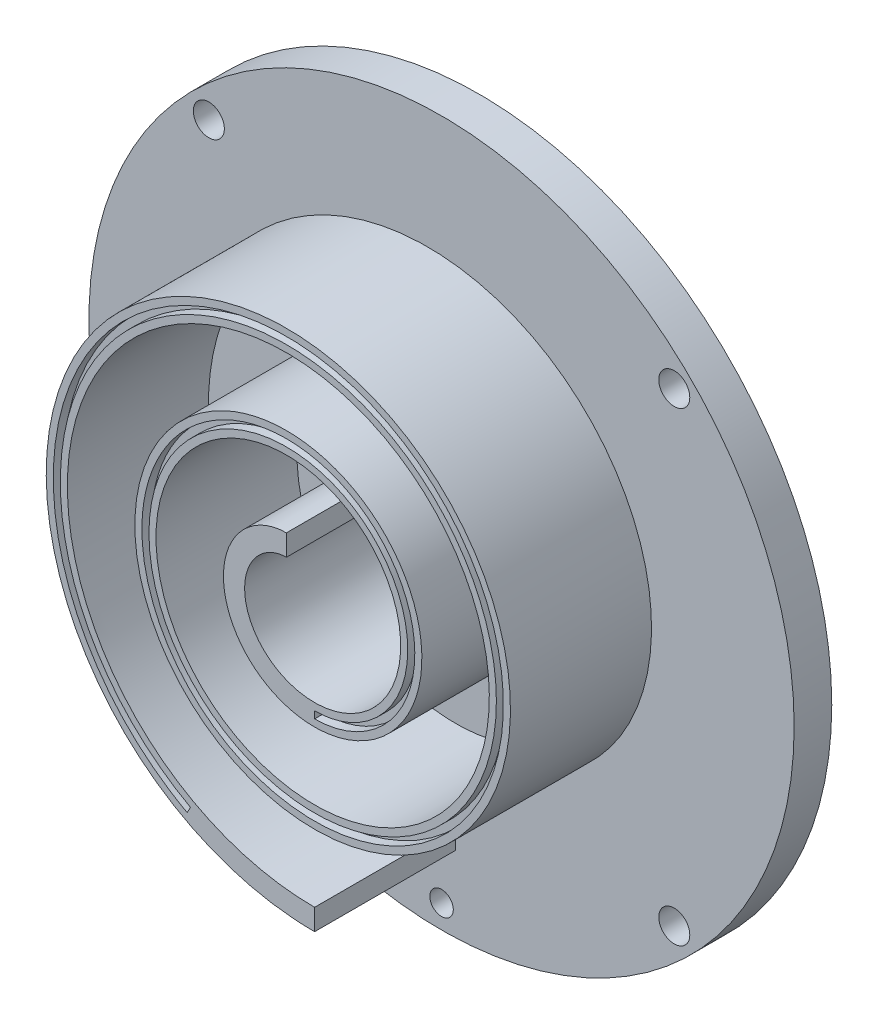
from build123d import *

# Parameters (mm, degrees)
SKETCH_1_R          = 75
EXTRUDE_1_DEPTH     = 8
EXTRUDE_2_DEPTH     = 30
CUT_EXTRUDE_1_DEPTH = 2
SKETCH_4_R          = 5
CUT_EXTRUDE_2_DEPTH = 151
SKETCH_5_R          = 3.3
CUT_EXTRUDE_3_DEPTH = 151
SKETCH_6_R          = 2.5
CUT_EXTRUDE_4_DEPTH = 151


with BuildPart() as part:
    # 草图1 → 凸台-拉伸1 (new body)
    with BuildSketch(Plane.XY):
        Circle(SKETCH_1_R)
    extrude(amount=EXTRUDE_1_DEPTH)

    # 草图2 → 凸台-拉伸2 (add)
    with BuildSketch(Plane.XY.offset(8)):
        with BuildLine():
            Line((3, -54.298668), (3, -58.79729))
            Line((3, -58.79729), (3, -58.798668))
            add(Edge.make_bspline(
                [(3, -58.798668), (2.399163725, -58.793351037), (1.19843255, -58.782725443), (-0.599559513, -58.696823613), (-2.391350558, -58.55998079), (-4.175267711, -58.367486226), (-5.949650082, -58.121031715), (-7.712851259, -57.820661267), (-9.463241735, -57.466927566), (-11.199207925, -57.060305538), (-12.919156155, -56.601354812), (-14.621511503, -56.090671901), (-16.304721417, -55.52890275), (-17.967257478, -54.916743876), (-19.607614199, -54.254929986), (-21.224312926, -53.544247219), (-22.815901623, -52.785521968), (-24.380956219, -51.979624306), (-25.918084432, -51.127468104), (-27.425923557, -50.230007536), (-28.90314069, -49.288231974), (-30.348441839, -48.303179229), (-31.760561458, -47.275915216), (-33.138274841, -46.207550095), (-34.48039039, -45.099224829), (-35.785754466, -43.952114907), (-37.053255735, -42.767433687), (-38.281814759, -41.546417556), (-39.470402531, -40.29034371), (-40.618022868, -39.000510051), (-41.723726567, -37.678246764), (-42.786605483, -36.324909452), (-43.805796004, -34.94187913), (-44.7804781, -33.530560058), (-45.709875216, -32.092378115), (-46.593262314, -30.628782975), (-47.429950938, -29.141239049), (-48.219309597, -27.631233319), (-48.960745024, -26.100266013), (-49.65371852, -24.549854443), (-50.297733421, -22.98152775), (-50.892346787, -21.396828633), (-51.437157395, -19.797307994), (-51.931820016, -18.184528203), (-52.376033478, -16.560057811), (-52.769546713, -14.925471308), (-53.112155687, -13.282347694), (-53.403712626, -11.632269388), (-53.644108011, -9.976818353), (-53.833290995, -8.317578092), (-53.971255602, -6.656129822), (-54.058041109, -4.994051756), (-54.093742061, -3.332917236), (-54.078498598, -1.674293185), (-54.012495364, -0.019738724), (-53.895969357, 1.629195389), (-53.729204079, 3.270969632), (-53.512525665, 4.904055859), (-53.246313981, 6.526940691), (-52.930985802, 8.138123828), (-52.567013431, 9.736123429), (-52.15490373, 11.319472854), (-51.695213297, 12.886725605), (-51.188542341, 14.436455638), (-50.635532525, 15.967258841), (-50.036865078, 17.477752453), (-49.393265664, 18.966579073), (-48.705501955, 20.432407242), (-47.974372287, 21.873928602), (-47.200724243, 23.289866958), (-46.385434055, 24.678970946), (-45.529422517, 26.040022955), (-44.633639962, 27.371833506), (-43.699071968, 28.67324441), (-42.72674119, 29.943133615), (-41.717698476, 31.180410128), (-40.67302916, 32.384019978), (-39.593846308, 33.552943062), (-38.481293754, 34.686197451), (-37.336541566, 35.782837617), (-36.160786422, 36.84195649), (-34.955252323, 37.862686625), (-33.721184007, 38.844197693), (-32.459853105, 39.785704312), (-31.172548609, 40.686456926), (-29.860582238, 41.54575156), (-28.52528296, 42.362922193), (-27.167998815, 43.137349812), (-25.790092445, 43.868454168), (-24.392941786, 44.555700731), (-22.977938708, 45.19859872), (-21.546486565, 45.796701082), (-20.099999393, 46.349603852), (-18.639900434, 46.856949863), (-17.167620331, 47.318422073), (-15.684597187, 47.733756025), (-14.192272979, 48.102723093), (-12.692094221, 48.425148445), (-11.185508795, 48.700894744), (-9.673965969, 48.92987347), (-8.158914732, 49.112043059), (-6.641801284, 49.247400277), (-5.124068626, 49.335992555), (-3.607155686, 49.377909769), (-2.092494786, 49.373284318), (-0.581511283, 49.322294808), (0.924378846, 49.225162034), (2.423769591, 49.082149981), (3.91526624, 48.89356556), (5.397486593, 48.659759233), (6.869063127, 48.381121974), (8.328641844, 48.058083759), (9.774888496, 47.691122966), (11.206482173, 47.280746971), (12.622125056, 46.827512534), (14.02053736, 46.332011045), (15.400459729, 45.7948685), (16.760657693, 45.216756546), (18.099917753, 44.598376682), (19.417052507, 43.940468062), (20.710899768, 43.243804774), (21.980323926, 42.509195083), (23.224216841, 41.73748088), (24.441500194, 40.92953689), (25.631121523, 40.086263613), (26.79206469, 39.208601044), (27.923339287, 38.297509994), (29.023989816, 37.353984298), (30.093093717, 36.379043614), (31.129761433, 35.373733577), (32.13313704, 34.339123477), (33.10240023, 33.276308112), (34.036769752, 32.186406964), (34.935493253, 31.070554345), (35.797864245, 29.929912795), (36.623206625, 28.765658252), (37.410884801, 27.578987356), (38.160303111, 26.371112947), (38.870902832, 25.143262759), (39.542165748, 23.896679448), (40.173611952, 22.632618381), (40.764801647, 21.352346257), (41.315337225, 20.057141391), (41.824858984, 18.748289939), (42.293047507, 17.427086468), (42.719628492, 16.094832909), (43.104363526, 14.752835841), (43.447057526, 13.40240578), (43.747555504, 12.044856623), (44.005744516, 10.681503127), (44.221550156, 9.313660978), (44.394943144, 7.942644529), (44.52592955, 6.569765701), (44.614561549, 5.196333071), (44.660924525, 3.823650673), (44.665152296, 2.453015949), (44.627410118, 1.085719487), (44.54791087, -0.276956926), (44.426897602, -1.633740068), (44.264660731, -2.983368981), (44.061523172, -4.324593905), (43.817847784, -5.656178545), (43.534036274, -6.976901287), (43.210519314, -8.285554405), (42.847777467, -9.580949415), (42.446312633, -10.861912382), (42.006670405, -12.127289726), (41.529429006, -13.375948694), (41.015197971, -14.606774447), (40.46462131, -15.818675866), (39.878376449, -17.010584489), (39.257169088, -18.181454588), (38.601736276, -19.330264885), (37.912848145, -20.456021221), (37.191297492, -21.557752702), (36.437911501, -22.634519062), (35.653538394, -23.68540606), (34.839058849, -24.70952543), (33.995364601, -25.706033368), (32.834104822, -26.995260991), (31.314179994, -28.53417107), (29.386951067, -30.259713946), (27.366369456, -31.856860964), (25.260939157, -33.320637483), (23.079366189, -34.64668758), (20.830583633, -35.831201319), (18.523698816, -36.870943919), (16.167966253, -37.76327032), (13.772741499, -38.506114199), (11.34745112, -39.098006303), (8.901550865, -39.538060906), (6.444493231, -39.825992572), (3.98568607, -39.962085986), (1.534460534, -39.94722032), (-0.899966031, -39.782830279), (-3.308524808, -39.470924245), (-5.682327373, -39.014044123), (-8.012702526, -38.415276178), (-10.291223256, -37.678210823), (-12.50974169, -36.806945801), (-14.66041309, -35.806045766), (-16.735728506, -34.680537627), (-18.728537915, -33.435874943), (-20.632074426, -32.077916772), (-22.439978298, -30.612902977), (-24.146319011, -29.047424734), (-25.745608211, -27.388393127), (-27.232828579, -25.643017361), (-28.603435001, -23.818763318), (-29.853375738, -21.923328855), (-30.979106595, -19.964612965), (-31.977589056, -17.95067636), (-32.84630975, -15.889716119), (-33.583272919, -13.790025888), (-34.18701355, -11.65996817), (-34.656593931, -9.507937937), (-34.9916007, -7.342330068), (-35.192139705, -5.171506949), (-35.258840866, -3.00376665), (-35.192833031, -0.847310827), (-34.995755121, 1.289787194), (-34.669724187, 3.399610566), (-34.217340793, 5.474430887), (-33.641658384, 7.506733276), (-32.946179176, 9.489247274), (-32.13482769, 11.414969863), (-31.211935122, 13.277191246), (-30.182217345, 15.069518493), (-29.050750458, 16.785895463), (-27.822948958, 18.420624106), (-26.50454521, 19.968386091), (-25.101554324, 21.424253354), (-23.620254973, 22.783708332), (-22.067159868, 24.042655656), (-20.448986113, 25.197433113), (-18.77263055, 26.244824331), (-17.04513463, 27.182059333), (-15.273662923, 28.006831477), (-13.465467655, 28.717293091), (-11.627859738, 29.312056129), (-9.768184142, 29.790207036), (-7.893783424, 30.151281828), (-6.011975311, 30.395288577), (-4.130020347, 30.522676756), (-2.255095363, 30.534355047), (-0.394265823, 30.431662495), (1.445541614, 30.216372013), (3.257562572, 29.890665363), (5.0352234, 29.457138411), (6.772160724, 28.918764204), (8.462249293, 28.278897798), (10.099616357, 27.541237515), (11.678670993, 26.709828568), (13.1941142, 25.789023863), (14.640962337, 24.78347337), (16.014560826, 23.698100366), (17.310600487, 22.538078308), (18.525124093, 21.308802269), (19.654551091, 20.015877143), (20.695669773, 18.665076687), (21.645664146, 17.262335169), (22.502100966, 15.813705775), (23.262954888, 14.325348693), (23.926592515, 12.803494273), (24.491788992, 11.254425227), (24.957716374, 9.684446165), (25.323953104, 8.099861382), (25.590468117, 6.506946135), (25.757625769, 4.911924322), (25.826175779, 3.320943723), (25.797246812, 1.740051611), (25.672329098, 0.175173238), (25.45327733, -1.367912474), (25.142285914, -2.88359209), (24.74188588, -4.366440801), (24.254918029, -5.811237353), (23.684533868, -7.212988841), (23.034159049, -8.566939723), (22.307491468, -9.868594479), (21.508478982, -11.113731206), (20.641291878, -12.298410489), (19.710313856, -13.418992936), (18.7201148, -14.472147283), (17.675429934, -15.454857106), (16.581141718, -16.364434898), (15.442255081, -17.198523185), (14.263873893, -17.955100037), (13.051182905, -18.632484569), (11.809421796, -19.229337331), (10.543864031, -19.744660202), (9.259796401, -20.177799897), (7.96249331, -20.528434592), (6.657200489, -20.796587306), (5.349108192, -20.982604585), (4.043334928, -21.087156765), (2.744906157, -21.11123461), (1.458734255, -21.056131551), (0.189600415, -20.923438745), (-1.057862934, -20.715036668), (-2.279188438, -20.433072508), (-3.470092151, -20.079961959), (-4.626486414, -19.658361336), (-5.744491917, -19.171157298), (-6.820456374, -18.621457434), (-7.850959133, -18.012561923), (-8.832827542, -17.347956481), (-9.763144237, -16.631291327), (-10.63925231, -15.866360066), (-11.458765357, -15.05708494), (-12.219575001, -14.207500612), (-12.919847667, -13.321726192), (-13.558036793, -12.403956519), (-14.132878167, -11.458436594), (-14.643391519, -10.489444361), (-15.088882335, -9.50127333), (-15.468936208, -8.498211471), (-15.783422718, -7.484525975), (-16.032476379, -6.464441064), (-16.216509686, -5.44212543), (-16.336193495, -4.421672648), (-16.392453095, -3.407083677), (-16.386460736, -2.402254334), (-16.319625286, -1.410957617), (-16.193579527, -0.436831771), (-16.010173617, 0.516635118), (-15.771460163, 1.446117229), (-15.479676845, 2.348460582), (-15.137241754, 3.220695732), (-14.746733125, 4.060045726), (-14.310879344, 4.863937858), (-13.832536613, 5.630005617), (-13.314681323, 6.356101036), (-12.7603904, 7.040295157), (-12.17282846, 7.680887402), (-11.555225656, 8.276400839), (-10.910870697, 8.825594305), (-10.243086097, 9.327454779), (-9.555216939, 9.781200262), (-8.850617017, 10.186282877), (-8.132626479, 10.542376743), (-7.404566095, 10.849383043), (-6.66971111, 11.107439414), (-5.931288534, 11.316801959), (-5.192454744, 11.478329239), (-4.456285569, 11.591617545), (-3.725764481, 11.661801679), (-3.240666522, 11.670474998), (-3, 11.674778)],
                knots=[0, 0, 0, 0, 0.003256773, 0.006508444, 0.009755014, 0.012996483, 0.016232849, 0.019464112, 0.022690274, 0.025911335, 0.029127293, 0.032338151, 0.035543905, 0.038744557, 0.041940107, 0.045130558, 0.048315904, 0.051496149, 0.054671292, 0.057841334, 0.061006274, 0.064166112, 0.067320847, 0.07047048, 0.073615013, 0.076754442, 0.079888771, 0.083017997, 0.08614212, 0.089261143, 0.092375063, 0.095483883, 0.0985876, 0.101686215, 0.104779728, 0.107868138, 0.110951449, 0.114029655, 0.117102761, 0.120170764, 0.123233665, 0.126291465, 0.129344162, 0.132391758, 0.135434254, 0.138471646, 0.141503936, 0.144531124, 0.14755321, 0.150570195, 0.153582078, 0.156588859, 0.159590537, 0.162587114, 0.165578589, 0.168564963, 0.171546234, 0.174522403, 0.177493471, 0.180459437, 0.1834203, 0.186376063, 0.189326724, 0.19227228, 0.195212736, 0.198148092, 0.201078343, 0.204003494, 0.206923543, 0.20983849, 0.212748334, 0.215653078, 0.218552719, 0.221447259, 0.224336696, 0.22722103, 0.230100265, 0.232974396, 0.235843424, 0.238707353, 0.241566179, 0.244419904, 0.247268525, 0.250112045, 0.252950464, 0.25578378, 0.258611996, 0.261435108, 0.264253118, 0.267066027, 0.269873834, 0.272676539, 0.275474144, 0.278266644, 0.281054044, 0.283836341, 0.286613537, 0.28938563, 0.292152622, 0.294914513, 0.2976713, 0.300422987, 0.30316957, 0.305911054, 0.308647435, 0.311378713, 0.314104889, 0.316825964, 0.319541937, 0.322252809, 0.324958576, 0.327659245, 0.330354809, 0.333045274, 0.335730634, 0.338410894, 0.341086053, 0.343756109, 0.346421063, 0.349080914, 0.351735665, 0.354385314, 0.35702986, 0.359669304, 0.362303647, 0.364932888, 0.367557026, 0.370176064, 0.372789998, 0.375398832, 0.378002564, 0.380601193, 0.38319472, 0.385783145, 0.38836647, 0.390944692, 0.393517812, 0.396085829, 0.398648745, 0.40120656, 0.403759272, 0.406306882, 0.408849392, 0.411386798, 0.413919103, 0.416446306, 0.418968408, 0.421485406, 0.423997304, 0.426504099, 0.429005793, 0.431502384, 0.433993874, 0.436480262, 0.438961548, 0.441437731, 0.443908814, 0.446374795, 0.448835673, 0.451291448, 0.453742124, 0.456187696, 0.458628166, 0.461063535, 0.463493803, 0.465918967, 0.468339031, 0.470753991, 0.473163852, 0.475568609, 0.477968264, 0.480362819, 0.482752271, 0.485136621, 0.487515869, 0.489890014, 0.492259058, 0.494623001, 0.496981842, 0.49933558, 0.504027199, 0.508698415, 0.513349224, 0.517979628, 0.522589626, 0.527179219, 0.531748408, 0.536297191, 0.540825569, 0.545333543, 0.549821111, 0.554288273, 0.55873503, 0.563161382, 0.56756733, 0.571952872, 0.576318009, 0.58066274, 0.584987066, 0.589290989, 0.593574504, 0.597837615, 0.602080321, 0.606302621, 0.610504518, 0.614686006, 0.618847092, 0.622987772, 0.627108046, 0.631207916, 0.635287381, 0.639346439, 0.643385095, 0.647403343, 0.651401187, 0.655378625, 0.659335659, 0.663272287, 0.66718851, 0.671084329, 0.674959741, 0.678814749, 0.682649352, 0.686463548, 0.69025734, 0.694030727, 0.697783709, 0.701516285, 0.705228457, 0.708920224, 0.712591585, 0.716242541, 0.719873091, 0.723483237, 0.727072976, 0.730642313, 0.734191243, 0.737719767, 0.741227888, 0.744715602, 0.748182911, 0.751629815, 0.755056314, 0.758462409, 0.761848097, 0.76521338, 0.768558259, 0.771882732, 0.7751868, 0.778470463, 0.781733721, 0.784976573, 0.788199021, 0.791401064, 0.794582699, 0.797743932, 0.800884759, 0.804005179, 0.807105196, 0.810184808, 0.813244014, 0.816282815, 0.819301209, 0.8222992, 0.825276786, 0.828233966, 0.831170742, 0.834087111, 0.836983075, 0.839858636, 0.84271379, 0.84554854, 0.848362883, 0.851156822, 0.853930355, 0.856683484, 0.859416207, 0.862128526, 0.864820439, 0.867491946, 0.870143049, 0.872773747, 0.875384039, 0.877973927, 0.880543408, 0.883092486, 0.885621157, 0.888129424, 0.890617285, 0.89308474, 0.895531793, 0.897958438, 0.900364678, 0.902750513, 0.905115945, 0.907460969, 0.909785589, 0.912089804, 0.914373614, 0.916637018, 0.918880017, 0.921102611, 0.923304802, 0.925486584, 0.927647963, 0.929788936, 0.931909504, 0.934009669, 0.936089426, 0.938148779, 0.940187727, 0.942206269, 0.944204407, 0.946182139, 0.948139466, 0.950076387, 0.951992903, 0.953889016, 0.955764722, 0.957620024, 0.959454918, 0.96126941, 0.963063496, 0.964837176, 0.966590451, 0.96832332, 0.970035786, 0.971727847, 0.973399501, 0.975050749, 0.976681595, 0.978292033, 0.979882068, 0.981451697, 0.983000921, 0.984529739, 0.986038151, 0.987526159, 0.988993763, 0.990440961, 0.991867753, 0.993274141, 0.994660123, 0.9960257, 0.997370872, 0.998695639, 1, 1, 1, 1], degree=3))
            Line((-3, 11.674778), (-3, 7.17467))
            add(Edge.make_bspline(
                [(-3, 7.17467), (-3.301005833, 7.163730291), (-3.918079079, 7.141303476), (-4.851790294, 6.959113795), (-5.800196038, 6.659196787), (-6.745661661, 6.224043616), (-7.669354317, 5.653415964), (-8.551579667, 4.945499295), (-9.372088364, 4.102648212), (-9.982059301, 3.299010945), (-10.420550009, 2.596605844), (-10.724703638, 2.035521357), (-10.998632776, 1.446619949), (-11.240068093, 0.831504433), (-11.44680876, 0.191992274), (-11.616758854, -0.469938904), (-11.747934724, -1.152142345), (-11.838481464, -1.852312321), (-11.886687086, -2.567991075), (-11.890983973, -3.296579139), (-11.849972076, -4.035342542), (-11.762421449, -4.781424236), (-11.627285208, -5.531854905), (-11.443706443, -6.283564764), (-11.211032545, -7.033396504), (-10.928814418, -7.778117065), (-10.596818196, -8.514432691), (-10.215027793, -9.239001944), (-9.783658558, -9.948454271), (-9.303144483, -10.639396486), (-8.774160424, -11.308439813), (-8.197607822, -11.952205372), (-7.574624745, -12.567345872), (-6.906582995, -13.150561314), (-6.195082957, -13.698609963), (-5.441958956, -14.208334594), (-4.649267055, -14.676666449), (-3.819286562, -15.10065191), (-2.95451031, -15.477460279), (-2.057638908, -15.804402963), (-1.1315734, -16.078947307), (-0.179405327, -16.298731827), (0.795593681, -16.461577763), (1.78998237, -16.565507549), (2.800162761, -16.608748939), (3.822391984, -16.589756649), (4.852796911, -16.507216035), (5.887388915, -16.360054746), (6.922079524, -16.147458162), (7.952695067, -15.868863875), (8.974996248, -15.523988191), (9.984690869, -15.112810397), (10.977458287, -14.635599573), (11.94895942, -14.092898112), (12.894864117, -13.485541947), (13.810861877, -12.814649062), (14.69268787, -12.081627149), (15.536136195, -11.288168675), (16.337083884, -10.436250867), (17.091506136, -9.528130707), (17.795497522, -8.566339894), (18.445290926, -7.553680634), (19.037273777, -6.493214762), (19.568007081, -5.388257985), (20.034245916, -4.242369538), (20.432950226, -3.059339656), (20.761308049, -1.843178439), (21.016744092, -0.598101303), (21.196939637, 0.671484529), (21.299845327, 1.960994899), (21.323690548, 3.265687108), (21.267001636, 4.580675874), (21.128607196, 5.900952868), (20.907648523, 7.221404156), (20.603591346, 8.536831196), (20.216229519, 9.841971023), (19.745692941, 11.131517965), (19.192449195, 12.400142536), (18.557311555, 13.642517132), (17.841436553, 14.853334638), (17.046323828, 16.027332195), (16.173820378, 17.159314988), (15.226110449, 18.244175188), (14.20571995, 19.276920125), (13.115500084, 20.252686194), (11.958632628, 21.166770695), (10.738610938, 22.014644858), (9.459236886, 22.791980051), (8.12460437, 23.494663936), (6.739093184, 24.118830258), (5.307345837, 24.660860059), (3.834263005, 25.117424145), (2.324976688, 25.485474282), (0.784839878, 25.762282124), (-0.780595761, 25.945442886), (-2.36560024, 26.032886867), (-3.964283666, 26.022904804), (-5.570620873, 25.914144345), (-7.178472767, 25.705638045), (-8.781609287, 25.39679005), (-10.373735042, 24.987407232), (-11.948511601, 24.477683816), (-13.499586276, 23.86822366), (-15.020613755, 23.16002732), (-16.505285083, 22.354505629), (-17.947351004, 21.453471468), (-19.340650399, 20.459142162), (-20.679131983, 19.374129041), (-21.95688853, 18.201442907), (-23.16817219, 16.944473907), (-24.307427185, 15.606992451), (-25.369308462, 14.193131925), (-26.348713877, 12.707383476), (-27.240797966, 11.154574699), (-28.041003537, 9.539860959), (-28.74507585, 7.868703095), (-29.349088781, 6.146853688), (-29.849459644, 4.380333335), (-30.242972224, 2.575413816), (-30.526793603, 0.738592998), (-30.698483087, -1.123427528), (-30.756015729, -3.003766979), (-30.697789924, -4.895390601), (-30.522638774, -6.791136097), (-30.229843248, -8.683741271), (-29.819133589, -10.565870776), (-29.290703255, -12.430145866), (-28.645206123, -14.269171491), (-27.883764939, -16.075566954), (-27.007970669, -17.841996707), (-26.01987308, -19.561193711), (-24.921994535, -21.226000098), (-23.717306006, -22.829384483), (-22.409235722, -24.364481066), (-21.001652762, -25.82461414), (-19.498856017, -27.20332483), (-17.905564619, -28.494403223), (-16.226902532, -29.691913167), (-14.468383604, -30.79022021), (-12.635891754, -31.784013964), (-10.735664229, -32.668337037), (-8.774267417, -33.438604168), (-6.758576554, -34.0906243), (-4.695752936, -34.620630143), (-2.593213948, -35.025277509), (-0.45861227, -35.301688921), (1.700196679, -35.447446289), (3.87518086, -35.460617293), (6.058162794, -35.33977116), (8.240849409, -35.083973092), (10.414864801, -34.692814867), (12.571780743, -34.166399853), (14.70315084, -33.505366043), (16.800543203, -32.710877893), (18.855571379, -31.784627534), (20.859932367, -30.728838736), (22.805436263, -29.54625956), (24.684041302, -28.240156286), (26.487884915, -26.814306106), (28.209319854, -25.272989587), (29.840940968, -23.620973859), (31.375622653, -21.863504428), (32.806545293, -20.006284226), (34.127222375, -18.055455658), (35.331539091, -16.017586107), (36.41376769, -13.899639521), (37.368601652, -11.708956971), (38.191177901, -9.453230468), (38.87709439, -7.140473606), (39.422447135, -4.778998559), (39.823826121, -2.377379994), (40.078358865, 0.055570125), (40.183709482, 2.510839817), (40.138091475, 4.979247168), (39.940296526, 7.451476554), (39.589685854, 9.918112123), (39.086203787, 12.369674984), (38.430393872, 14.79666044), (37.623380812, 17.189571216), (36.666891884, 19.538958227), (35.563243292, 21.835457772), (34.315340086, 24.069821918), (32.92665999, 26.232979043), (31.401305324, 28.315991692), (30.021469267, 29.976204711), (28.854538112, 31.255757518), (27.947279505, 32.191254668), (27.009734166, 33.100439371), (26.04265161, 33.982342384), (25.046827897, 34.836001912), (24.023088326, 35.660485368), (22.972286427, 36.454880345), (21.89530756, 37.218302636), (20.793063612, 37.94988975), (19.666498233, 38.64881137), (18.516579812, 39.314261523), (17.34430286, 39.945462288), (16.150689817, 40.541670298), (14.936786193, 41.102168297), (13.703660309, 41.626268698), (12.452407252, 42.113323004), (11.18414051, 42.562708643), (9.899996556, 42.973840543), (8.601130696, 43.346166188), (7.288717707, 43.679168099), (5.963950119, 43.972366277), (4.628037612, 44.225314725), (3.282204702, 44.437604682), (1.927691793, 44.60886611), (0.565751434, 44.738766404), (-0.802350879, 44.827009275), (-2.175338744, 44.873342066), (-3.551925689, 44.877542296), (-4.930816396, 44.839438718), (-6.310708499, 44.758889069), (-7.690293499, 44.635799608), (-9.068257711, 44.470112271), (-10.443283157, 44.261811249), (-11.814049999, 44.010921774), (-13.179236458, 43.717508688), (-14.537521779, 43.381679167), (-15.887585272, 43.003579155), (-17.228111238, 42.583402637), (-18.55778416, 42.121373358), (-19.875297337, 41.617768775), (-21.179348043, 41.072896752), (-22.468641569, 40.487110071), (-23.741895494, 39.860807002), (-24.997831328, 39.194414871), (-26.23518816, 38.488412957), (-27.452715201, 37.743313627), (-28.64917543, 36.959669425), (-29.823349611, 36.138075103), (-30.97403128, 35.279159937), (-32.10003409, 34.383593336), (-33.200192334, 33.452085183), (-34.27335608, 32.485376187), (-35.318400653, 31.484249649), (-36.334223851, 30.449524078), (-37.319743073, 29.382048876), (-38.273905538, 28.282713183), (-39.195683004, 27.152438149), (-40.084072254, 25.992176985), (-40.93809911, 24.802916508), (-41.756819395, 23.585674703), (-42.539321406, 22.341502933), (-43.284717282, 21.071476361), (-43.992161311, 19.776706044), (-44.660830818, 18.45832406), (-45.289945734, 17.117495213), (-45.87875411, 15.755406704), (-46.426546809, 14.373273317), (-46.932641498, 12.972329951), (-47.396404451, 11.553837704), (-47.817229762, 10.119076751), (-48.194559563, 8.669349796), (-48.527867651, 7.205976755), (-48.816672447, 5.730296622), (-49.060533927, 4.243665292), (-49.259048621, 2.747453568), (-49.411858827, 1.243047016), (-49.518650824, -0.268155917), (-49.579147361, -1.784745507), (-49.593121553, -3.305301243), (-49.560384365, -4.828393469), (-49.480797162, -6.35258497), (-49.354257622, -7.876431897), (-49.180713938, -9.398485926), (-48.960158046, -10.917295118), (-48.692626027, -12.431405523), (-48.378197745, -13.939361248), (-48.016999541, -15.439707836), (-47.609205072, -16.930992791), (-47.155028755, -18.4117668), (-46.654733975, -19.880585787), (-46.108625154, -21.336010744), (-45.517057999, -22.77661233), (-44.880423719, -24.200966668), (-44.199170013, -25.607665331), (-43.473775679, -26.995306132), (-42.704773949, -28.362504736), (-41.892734754, -29.707887987), (-41.038277016, -31.030101679), (-40.142057292, -32.32780602), (-39.204777482, -33.599682159), (-38.227180326, -34.8444303), (-37.21004835, -36.060770567), (-36.154207837, -37.247448932), (-35.060521123, -38.403231348), (-33.929893215, -39.526912999), (-32.763265731, -40.61731228), (-31.56161752, -41.673276324), (-30.325965261, -42.693680551), (-29.057364146, -43.6774343), (-27.756897794, -44.623469581), (-26.425691432, -45.530759998), (-25.064898965, -46.398306871), (-23.675708608, -47.225148391), (-22.259338754, -48.010356605), (-20.817038807, -48.753041677), (-19.35008608, -49.452348857), (-17.859788123, -50.107466936), (-16.347475934, -50.717616715), (-14.814509907, -51.282067121), (-13.262271405, -51.800121469), (-11.692167513, -52.271129694), (-10.105625706, -52.694480691), (-8.504095073, -53.069611611), (-6.889043171, -53.395994134), (-5.2619549, -53.673172227), (-3.624333548, -53.900631455), (-1.977695596, -54.078311214), (-0.323572997, -54.204638727), (1.336490847, -54.283948648), (2.445183278, -54.293758774), (3, -54.298668)],
                knots=[0, 0, 0, 0, 0.001869469, 0.003832482, 0.00588902, 0.008039089, 0.010282685, 0.012619808, 0.01505046, 0.017574641, 0.018872415, 0.020193582, 0.021538141, 0.022906094, 0.024297441, 0.02571218, 0.027150313, 0.028611839, 0.030096756, 0.031605067, 0.033136773, 0.03469187, 0.036270359, 0.037872243, 0.039497521, 0.04114619, 0.042818252, 0.044513707, 0.046232557, 0.047974798, 0.049740433, 0.051529462, 0.053341883, 0.055177696, 0.057036904, 0.058919503, 0.060825497, 0.062754882, 0.064707662, 0.066683834, 0.0686834, 0.070706359, 0.072752709, 0.074822454, 0.076915592, 0.079032123, 0.081172047, 0.083335363, 0.085522073, 0.087732175, 0.089965672, 0.09222256, 0.094502842, 0.096806518, 0.099133585, 0.101484047, 0.1038579, 0.106255148, 0.108675788, 0.111119822, 0.113587248, 0.116078068, 0.118592279, 0.121129886, 0.123690885, 0.126275276, 0.12888306, 0.131514237, 0.134168808, 0.136846773, 0.139548129, 0.142272879, 0.145021023, 0.147792559, 0.150587488, 0.15340581, 0.156247524, 0.159112634, 0.162001133, 0.164913028, 0.167848316, 0.170806996, 0.17378907, 0.176794537, 0.179823395, 0.182875649, 0.185951294, 0.189050333, 0.192172764, 0.195318588, 0.198487807, 0.201680418, 0.204896422, 0.208135818, 0.21139861, 0.214684791, 0.217994369, 0.221327337, 0.224683699, 0.228063455, 0.231466604, 0.234893145, 0.238343079, 0.241816406, 0.245313127, 0.248833242, 0.252376748, 0.255943647, 0.25953394, 0.263147625, 0.266784704, 0.270445176, 0.274129041, 0.277836299, 0.281566951, 0.285320994, 0.289098433, 0.292899262, 0.296723485, 0.300571102, 0.304442112, 0.308336513, 0.31225431, 0.316195498, 0.320160078, 0.324148053, 0.328159421, 0.332194181, 0.336252337, 0.340333883, 0.344438823, 0.348567155, 0.352718881, 0.356894001, 0.361092513, 0.365314418, 0.369559715, 0.373828407, 0.378120492, 0.382435969, 0.38677484, 0.391137102, 0.395522759, 0.399931808, 0.40436425, 0.408820086, 0.413299315, 0.417801936, 0.422327951, 0.426877359, 0.43145016, 0.436046353, 0.440665941, 0.445308921, 0.449975294, 0.454665059, 0.459378219, 0.46411477, 0.468874716, 0.473658055, 0.478464786, 0.483294911, 0.488148428, 0.493025339, 0.497925641, 0.502849338, 0.507796428, 0.51276691, 0.517760785, 0.522778054, 0.527818717, 0.532882772, 0.537970219, 0.543081061, 0.548215294, 0.553372922, 0.558553941, 0.563758355, 0.568986162, 0.574237361, 0.579511953, 0.584809938, 0.590131317, 0.595476089, 0.600844253, 0.603537425, 0.606236445, 0.608941314, 0.611652033, 0.6143686, 0.617091016, 0.61981928, 0.622553395, 0.62529336, 0.628039172, 0.630790833, 0.633548342, 0.636311699, 0.639080909, 0.641855965, 0.644636871, 0.647423626, 0.65021623, 0.653014682, 0.655818984, 0.658629134, 0.661445135, 0.664266982, 0.66709468, 0.669928226, 0.672767622, 0.675612866, 0.67846396, 0.681320902, 0.684183691, 0.687052331, 0.689926821, 0.692807159, 0.695693345, 0.698585382, 0.701483265, 0.704386999, 0.707296583, 0.710212014, 0.713133296, 0.716060424, 0.718993403, 0.721932231, 0.724876907, 0.727827433, 0.730783806, 0.733746029, 0.736714102, 0.739688023, 0.742667792, 0.745653412, 0.74864488, 0.751642197, 0.754645364, 0.757654377, 0.760669241, 0.763689955, 0.766716516, 0.769748928, 0.772787187, 0.775831296, 0.778881252, 0.781937058, 0.784998713, 0.788066219, 0.791139572, 0.794218773, 0.797303825, 0.800394725, 0.803491474, 0.806594072, 0.809702519, 0.812816815, 0.815936961, 0.819062954, 0.822194797, 0.825332488, 0.828476029, 0.831625419, 0.834780658, 0.837941746, 0.841108682, 0.844281467, 0.847460101, 0.850644584, 0.853834918, 0.857031098, 0.860233128, 0.863441007, 0.866654735, 0.869874313, 0.873099739, 0.876331014, 0.879568138, 0.882811111, 0.886059933, 0.889314604, 0.892575124, 0.895841492, 0.899113709, 0.902391777, 0.905675692, 0.908965455, 0.91226107, 0.915562531, 0.918869843, 0.922183003, 0.925502013, 0.928826871, 0.932157577, 0.935494134, 0.938836538, 0.942184792, 0.945538896, 0.948898847, 0.952264648, 0.955636298, 0.959013796, 0.962397144, 0.965786341, 0.969181388, 0.972582282, 0.975989025, 0.979401617, 0.982820058, 0.986244349, 0.989674489, 0.993110477, 0.996552315, 1, 1, 1, 1], degree=3))
        make_face()
    extrude(amount=EXTRUDE_2_DEPTH)

    # 草图3 → 切除-拉伸1 (cut)
    with BuildSketch(Plane.XY.offset(38)):
        with BuildLine():
            Line((-23.39942, -49.089841), (-24.118659, -50.40627))
            add(Edge.make_bspline(
                [(-24.118659, -50.40627), (-24.881298117, -49.976033187), (-26.404658106, -49.116641725), (-28.606783247, -47.694831253), (-30.738552417, -46.182249904), (-32.790239381, -44.573003556), (-34.759098636, -42.873769907), (-36.640787561, -41.088102678), (-38.431660627, -39.220610132), (-40.128166179, -37.275825069), (-41.727016406, -35.258493796), (-43.225149238, -33.173482811), (-44.619749765, -31.025792799), (-45.908244343, -28.820534337), (-47.08831753, -26.562924967), (-48.157900221, -24.258267703), (-49.1151904, -21.911948152), (-49.958641084, -19.529414693), (-50.686970439, -17.11616886), (-51.299165243, -14.677753447), (-51.794472117, -12.219736507), (-52.172405942, -9.747702117), (-52.432753296, -7.267236785), (-52.575555002, -4.783915356), (-52.601123687, -2.303290105), (-52.510031556, 0.169122668), (-52.303107169, 2.627854565), (-51.981435813, 5.067496135), (-51.546356147, 7.482711305), (-50.999452827, 9.868246261), (-50.342553318, 12.218943301), (-49.57771944, 14.529748765), (-48.707249473, 16.795728762), (-47.733660651, 19.012073853), (-46.659693358, 21.174115003), (-45.488292674, 23.27732786), (-44.222613361, 25.317348849), (-42.865996962, 27.289975337), (-41.421977068, 29.191183358), (-39.894259872, 31.017128889), (-38.286719975, 32.764158631), (-36.6033928, 34.428819586), (-34.848457064, 36.007859018), (-33.026231271, 37.498237035), (-31.141162408, 38.897131231), (-29.197809525, 40.201935478), (-27.200841507, 41.410275834), (-25.155018032, 42.520004552), (-23.065183519, 43.529209504), (-20.93625231, 44.436212873), (-18.773201157, 45.239582191), (-16.581051353, 45.938116818), (-14.364864447, 46.530868652), (-12.129724418, 47.017123288), (-9.880730156, 47.396417232), (-7.62298162, 47.668528449), (-5.361568543, 47.833473228), (-3.101559818, 47.891514609), (-0.847991658, 47.843148404), (1.394143776, 47.689113997), (3.619909326, 47.430378053), (5.824433379, 47.068139951), (8.002921324, 46.603822693), (10.150665265, 46.039074758), (12.263054295, 45.37575588), (14.335584444, 44.615939801), (16.363868643, 43.761903945), (18.343645149, 42.816124044), (20.27078702, 41.781267878), (22.141312142, 40.660189063), (23.951386537, 39.455913386), (25.697340329, 38.17164244), (27.37566558, 36.81073267), (28.98302901, 35.376693738), (30.516283116, 33.873184869), (31.972455753, 32.303987379), (33.348778773, 30.673020236), (34.642671238, 28.984307242), (35.851760008, 27.241983351), (36.973874128, 25.450275868), (38.007056407, 23.613499655), (38.949553725, 21.736039846), (39.799841502, 19.82235178), (40.556598959, 17.876938876), (41.218732621, 15.904350801), (41.785368748, 13.90916931), (42.255853384, 11.895997522), (42.629749612, 9.869449661), (42.906848777, 7.834142075), (43.087153885, 5.794679647), (43.170894956, 3.755647927), (43.158509103, 1.721601738), (43.050655782, -0.302944497), (42.848199961, -2.313527228), (42.552216085, -4.305743495), (42.163983472, -6.275260486), (41.684982567, -8.217825403), (41.116883602, -10.12927294), (40.461555294, -12.005537522), (39.72104218, -13.842657425), (38.897574192, -15.636787523), (37.993549718, -17.384204292), (37.011536505, -19.081316217), (35.954258517, -20.724667275), (34.824592767, -22.310947005), (33.62556066, -23.836996744), (32.360319451, -25.299815268), (31.032153162, -26.696563497), (29.644469057, -28.024572836), (28.200782605, -29.281346803), (26.704713845, -30.464567578), (25.159974891, -31.572099309), (23.570364134, -32.601993246), (21.939753579, -33.552489947), (20.272080723, -34.422018709), (18.571340965, -35.209207182), (16.841575035, -35.912874471), (15.086863668, -36.532043679), (13.311311369, -37.065927255), (11.519044625, -37.513943593), (9.714195927, -37.875707511), (7.900897818, -38.151028458), (6.083272205, -38.339920121), (4.265421542, -38.442583869), (2.451419266, -38.459421959), (0.645300551, -38.391022209), (-1.148947484, -38.238168711), (-2.927391909, -38.001821234), (-4.686165578, -37.683133415), (-6.421473503, -37.283427283), (-8.12960201, -36.804202927), (-9.806928028, -36.247133058), (-11.449922036, -35.614046705), (-13.055162278, -34.906940738), (-14.619334514, -34.127956526), (-16.139246387, -33.279390421), (-17.611826191, -32.363672625), (-19.034137515, -31.383374133), (-20.403374298, -30.341185653), (-21.716878387, -29.239925584), (-22.972133902, -28.082519166), (-24.16677892, -26.871999538), (-25.298609669, -25.61149872), (-26.365574092, -24.304232015), (-27.365795506, -22.95350577), (-28.297551183, -21.56268967), (-29.15929762, -20.135225333), (-29.949655729, -18.674606464), (-30.667425085, -17.184377758), (-31.311574487, -15.668120518), (-31.881253323, -14.12944955), (-32.375785461, -12.57200012), (-32.794671419, -10.99942217), (-33.137585081, -9.415369558), (-33.404381642, -7.823494819), (-33.595087312, -6.227437049), (-33.709901825, -4.630815993), (-33.749197903, -3.03722306), (-33.713515171, -1.450213779), (-33.603560202, 0.126701123), (-33.420206663, 1.690062728), (-33.16448389, 3.23647158), (-32.83757849, 4.76259501), (-32.440833538, 6.265175363), (-31.975736333, 7.741035188), (-31.443919489, 9.18708492), (-30.847153849, 10.600329323), (-30.187343497, 11.977874277), (-29.466521377, 13.316931254), (-28.686840008, 14.614823267), (-27.850571367, 15.868990917), (-26.960095493, 17.076997862), (-26.017895728, 18.236532872), (-25.02655161, 19.345416168), (-23.988734464, 20.401603973), (-22.907197971, 21.403191285), (-21.784769973, 22.348413052), (-20.624349575, 23.235651373), (-19.428894415, 24.063432289), (-18.201419811, 24.830437157), (-16.944983267, 25.535492837), (-15.662683323, 26.177580966), (-14.357649777, 26.755838283), (-13.033035953, 27.269554072), (-11.692010802, 27.718172903), (-10.337752972, 28.101293889), (-8.973441293, 28.418671523), (-7.602248587, 28.670212476), (-6.22733311, 28.855973541), (-4.851833942, 28.976168436), (-3.478860523, 29.031154334), (-2.111488104, 29.021435507), (-0.752748883, 28.947665249), (0.594372872, 28.810629945), (1.926948527, 28.611263068), (3.242111453, 28.350628184), (4.537061737, 28.029918091), (5.809074935, 27.65045686), (7.055504562, 27.213688515), (8.273790284, 26.721176522), (9.461461602, 26.174598216), (10.616142482, 25.575736451), (11.735558028, 24.926481048), (12.817535713, 24.228814782), (13.860015734, 23.484820161), (14.861042831, 22.696654337), (15.818787419, 21.866568607), (16.73152878, 20.996875785), (17.59767708, 20.089966788), (18.415758431, 19.148285989), (19.184435212, 18.174341229), (19.902487856, 17.17068108), (20.568835599, 16.139902573), (21.182526152, 15.084637119), (21.742737039, 14.007542302), (22.248783881, 12.911302239), (22.700111538, 11.798613767), (23.09629959, 10.672185255), (23.437060494, 9.534727069), (23.722241595, 8.388946562), (23.951814962, 7.237539477), (24.125892446, 6.08318699), (24.24470103, 4.928545979), (24.308610467, 3.776246338), (24.318097073, 2.628881704), (24.273775547, 1.489006208), (24.176368756, 0.359126751), (24.026718007, -0.758300376), (23.825780104, -1.860877084), (23.574619435, -2.946266621), (23.274404315, -4.012199403), (22.926408397, -5.05647872), (22.53199893, -6.076983372), (22.092639534, -7.071673521), (21.609879531, -8.038592903), (21.085353734, -8.975874865), (20.520775693, -9.881744568), (19.917931195, -10.754521301), (19.27867834, -11.592624627), (18.604934734, -12.39457312), (17.89867908, -13.158990465), (17.161941174, -13.884604213), (16.396798303, -14.570250742), (15.605368651, -15.214874182), (14.789808199, -15.817532075), (13.952299706, -16.377386962), (13.095055576, -16.893723126), (12.22030071, -17.365926035), (11.330278703, -17.793503977), (10.427238193, -18.176071417), (9.513429546, -18.513358698), (8.591100119, -18.805199272), (7.662488879, -19.051569308), (6.729818493, -19.252444023), (5.795292902, -19.408288737), (4.861091565, -19.51828353), (3.929363504, -19.586856188), (3.309047261, -19.595332849), (3, -19.599556)],
                knots=[0, 0, 0, 0, 0.005774209, 0.011533894, 0.017278928, 0.023009311, 0.028725042, 0.03442612, 0.040112548, 0.045784323, 0.051441448, 0.057083921, 0.062711742, 0.068324911, 0.073923428, 0.079507294, 0.08507651, 0.090631072, 0.096170982, 0.101696242, 0.107206849, 0.112702805, 0.11818411, 0.123650763, 0.129102762, 0.134540112, 0.13996281, 0.145370856, 0.150764249, 0.156142993, 0.161507084, 0.166856523, 0.172191311, 0.177511448, 0.182816931, 0.188107763, 0.193383945, 0.198645475, 0.203892352, 0.209124578, 0.214342152, 0.219545074, 0.224733345, 0.229906964, 0.235065933, 0.240210248, 0.245339913, 0.250454926, 0.255555287, 0.260640996, 0.265712054, 0.27076846, 0.275810215, 0.280837318, 0.285849769, 0.290847568, 0.295830716, 0.300799211, 0.305753056, 0.310692249, 0.315616789, 0.32052668, 0.325421916, 0.330302503, 0.335168437, 0.34001972, 0.344856351, 0.349678331, 0.354485659, 0.359278334, 0.364056359, 0.368819732, 0.373568454, 0.378302523, 0.383021941, 0.387726706, 0.392416821, 0.397092283, 0.401753094, 0.406399255, 0.411030762, 0.415647619, 0.420249823, 0.424837377, 0.429410277, 0.433968526, 0.438512125, 0.443041072, 0.447555365, 0.452055008, 0.456539999, 0.461010339, 0.465466027, 0.469907063, 0.474333447, 0.47874518, 0.483142261, 0.487524691, 0.49189247, 0.496245595, 0.500584069, 0.504907892, 0.509217063, 0.513511585, 0.517791452, 0.522056666, 0.526307232, 0.530543144, 0.534764406, 0.538971016, 0.543162975, 0.547340281, 0.551502935, 0.555650937, 0.559784289, 0.563902988, 0.568007036, 0.572096434, 0.576171177, 0.580231272, 0.584276711, 0.588307501, 0.592323639, 0.596325127, 0.600311961, 0.604284143, 0.608241674, 0.612184556, 0.616112784, 0.620026358, 0.623925284, 0.627809557, 0.631679178, 0.635534148, 0.639374466, 0.643200131, 0.647011147, 0.650807509, 0.654589221, 0.658356281, 0.662108688, 0.665846444, 0.66956955, 0.673278003, 0.676971804, 0.680650954, 0.684315451, 0.687965298, 0.691600493, 0.695221036, 0.698826928, 0.702418167, 0.705994756, 0.709556693, 0.713103977, 0.71663661, 0.720154592, 0.723657921, 0.7271466, 0.730620626, 0.734080001, 0.737524725, 0.740954795, 0.744370215, 0.747770984, 0.7511571, 0.754528564, 0.757885377, 0.761227539, 0.764555048, 0.767867907, 0.771166112, 0.774449668, 0.777718571, 0.780972822, 0.784212422, 0.787437371, 0.790647668, 0.793843313, 0.797024305, 0.800190647, 0.803342337, 0.806479374, 0.809601762, 0.812709497, 0.81580258, 0.81888101, 0.821944791, 0.824993918, 0.828028396, 0.831048221, 0.834053394, 0.837043915, 0.840019785, 0.842981004, 0.845927569, 0.848859485, 0.851776748, 0.85467936, 0.85756732, 0.860440629, 0.863299285, 0.86614329, 0.868972643, 0.871787344, 0.874587394, 0.877372793, 0.880143539, 0.882899634, 0.885641078, 0.888367869, 0.89108001, 0.893777498, 0.896460335, 0.899128518, 0.901782052, 0.904420934, 0.907045165, 0.909654743, 0.912249669, 0.914829944, 0.917395567, 0.919946539, 0.922482859, 0.925004527, 0.927511544, 0.930003908, 0.932481623, 0.934944685, 0.937393095, 0.939826853, 0.942245959, 0.944650414, 0.947040219, 0.94941537, 0.951775868, 0.954121718, 0.956452915, 0.958769459, 0.961071352, 0.963358595, 0.965631186, 0.967889122, 0.97013241, 0.972361045, 0.974575029, 0.97677436, 0.978959041, 0.981129069, 0.983284447, 0.98542517, 0.987551244, 0.989662666, 0.991759435, 0.993841554, 0.995909022, 0.997961837, 1, 1, 1, 1], degree=3))
            Line((3, -19.599556), (3, -18.099556))
            add(Edge.make_bspline(
                [(3, -18.099556), (3.285480209, -18.095653652), (3.858662353, -18.087818586), (4.719845969, -18.024429888), (5.583817016, -17.922700951), (6.448580988, -17.778480521), (7.312115416, -17.592491246), (8.172369156, -17.364252552), (9.027270504, -17.093739654), (9.87473144, -16.780936181), (10.712651231, -16.425950485), (11.538924539, -16.028992616), (12.35144292, -15.590376599), (13.148105415, -15.110527892), (13.926815571, -14.589969096), (14.685495832, -14.029336796), (15.422087982, -13.429370873), (16.134558299, -12.790916372), (16.820907139, -12.114925293), (17.47916628, -11.402448665), (18.107413456, -10.654643925), (18.703773934, -9.872769551), (19.266420003, -9.058178387), (19.793587957, -8.212324845), (20.283571943, -7.336754322), (20.73473835, -6.433106248), (21.145517233, -5.503104928), (21.514427962, -4.548564558), (21.840060148, -3.571377199), (22.121098414, -2.573515795), (22.356310084, -1.557025348), (22.544563298, -0.524022907), (22.684821332, 0.523309783), (22.776150033, 1.582729894), (22.817720532, 2.651937981), (22.808810035, 3.72858402), (22.748815182, 4.810270753), (22.637238448, 5.89456137), (22.473704512, 6.978982955), (22.257953215, 8.061033053), (21.989848465, 9.138185287), (21.669379903, 10.207896411), (21.296650472, 11.267608239), (20.871901503, 12.314759907), (20.395490853, 13.346788159), (19.867909647, 14.361139205), (19.289767996, 15.355267964), (18.661811088, 16.326652833), (17.98490242, 17.27279193), (17.260038255, 18.191221491), (16.488331718, 19.079509033), (15.671026434, 19.935273182), (14.809481823, 20.756177074), (13.905177041, 21.53994166), (12.959711298, 22.284353313), (11.974793543, 22.987262558), (10.952249541, 23.646599838), (9.89400752, 24.260369661), (8.802104964, 24.826668165), (7.678675762, 25.343676519), (6.525954663, 25.809678791), (5.346265764, 26.223055452), (4.142021338, 26.582295054), (2.915716992, 26.886000006), (1.669925173, 27.132883603), (0.407291553, 27.32178313), (-0.86947255, 27.451655936), (-2.15759493, 27.52158976), (-3.454248533, 27.53080057), (-4.756557156, 27.478641197), (-6.061603451, 27.364598388), (-7.36643373, 27.18830187), (-8.668065859, 26.949517457), (-9.963494736, 26.648160067), (-11.249701483, 26.284287183), (-12.52365712, 25.858100208), (-13.782334258, 25.369953485), (-15.022707774, 24.820341351), (-16.241770435, 24.209915253), (-17.436530388, 23.539464156), (-18.604028264, 22.809932231), (-19.741338158, 22.022408198), (-20.845575871, 21.17812317), (-21.913904665, 20.27845122), (-22.943552162, 19.324915745), (-23.931798838, 18.319168436), (-24.876005193, 17.263006004), (-25.773604169, 16.158354939), (-26.622114741, 15.007272042), (-27.419145574, 13.811941991), (-28.162405599, 12.574671373), (-28.84970328, 11.2978846), (-29.478960352, 9.984120122), (-30.048211932, 8.63602478), (-30.555614305, 7.25634828), (-30.999452047, 5.847938409), (-31.37813922, 4.413735044), (-31.690228286, 2.956763052), (-31.93440829, 1.48012687), (-32.10952136, -0.012995617), (-32.214552891, -1.519360909), (-32.248643697, -3.035666989), (-32.211086888, -4.558560106), (-32.101341267, -6.08464215), (-31.919022757, -7.610477965), (-31.663912622, -9.132603965), (-31.335958072, -10.647535611), (-30.935273486, -12.15177509), (-30.462139941, -13.641818337), (-29.917013182, -15.114166826), (-29.300512867, -16.565331672), (-28.613429412, -17.991843559), (-27.856723909, -19.390261397), (-27.031526007, -20.75718085), (-26.139127683, -22.089239317), (-25.180992384, -23.383130858), (-24.158739915, -24.635604293), (-23.074159205, -25.843484543), (-21.929186136, -27.003663922), (-20.725920657, -28.113127936), (-19.466608851, -29.16894984), (-18.153644143, -30.168302096), (-16.789562038, -31.108465346), (-15.377036235, -31.98683365), (-13.918872077, -32.800922373), (-12.418003311, -33.548376541), (-10.877482098, -34.226971737), (-9.300477726, -34.834625528), (-7.690267422, -35.369403179), (-6.050229836, -35.829519866), (-4.383837519, -36.213349136), (-2.694651614, -36.519425813), (-0.986311448, -36.746451889), (0.737470479, -36.893301358), (2.472919496, -36.959020176), (4.2162039, -36.942835843), (5.963445774, -36.844156078), (7.710728723, -36.662572653), (9.454106868, -36.397864476), (11.189612994, -36.049995343), (12.913269646, -35.619128003), (14.621094543, -35.105604262), (16.309114351, -34.50996632), (17.97337059, -33.832944502), (19.609929532, -33.075459295), (21.214892387, -32.23862442), (22.784403223, -31.323740119), (24.314659871, -30.332297231), (25.801922332, -29.265971349), (27.242518886, -28.126617859), (28.632862839, -26.916277637), (29.969450541, -25.637162512), (31.248880814, -24.291661711), (32.467856585, -22.88233107), (33.623193841, -21.411888671), (34.71183242, -19.883212782), (35.730843249, -18.299335286), (36.67743588, -16.663434783), (37.548960651, -14.978828735), (38.342926155, -13.248972102), (39.056996061, -11.477443562), (39.689003143, -9.667944483), (40.236951256, -7.82428632), (40.699019601, -5.950385669), (41.073570515, -4.050253379), (41.359158544, -2.12798984), (41.554526791, -0.187771968), (41.658616389, 1.766153192), (41.670566769, 3.729479511), (41.589727292, 5.697849885), (41.415645302, 7.666865954), (41.148084201, 9.632098792), (40.787016548, 11.589098709), (40.332623714, 13.533404309), (39.785307224, 15.460554957), (39.145674901, 17.366097455), (38.414552015, 19.245598807), (37.592980178, 21.094658007), (36.682207363, 22.908911465), (35.683695853, 24.684048431), (34.599116203, 26.415817184), (33.430345413, 28.10003827), (32.179462764, 29.732611787), (30.848747949, 31.309529708), (29.440677554, 32.826884864), (27.957917937, 34.28087852), (26.403323445, 35.66783351), (24.779927676, 36.984198499), (23.090942193, 38.226563594), (21.33974581, 39.391662388), (19.529880325, 40.476383863), (17.665042815, 41.477779323), (15.749078939, 42.393072673), (13.785972174, 43.219660239), (11.779841029, 43.955132608), (9.734923746, 44.597260366), (7.655575153, 45.144022796), (5.546254109, 45.593594752), (3.411514602, 45.944363974), (1.255997086, 46.194931896), (-0.915584045, 46.344116682), (-3.098447358, 46.390961651), (-5.287758284, 46.334734777), (-7.478637301, 46.174931177), (-9.666172975, 45.911280626), (-11.845430725, 45.543744802), (-14.011465705, 45.072521709), (-16.159332262, 44.498040997), (-18.284098091, 43.820974448), (-20.380852934, 43.042227209), (-22.444720569, 42.162939709), (-24.470869611, 41.184486107), (-26.454527493, 40.10847571), (-28.390987887, 38.936745326), (-30.275624563, 37.67136022), (-32.103901207, 36.314609972), (-33.871382177, 34.869003481), (-35.573743861, 33.337265242), (-37.206783968, 31.722330257), (-38.766435318, 30.027340293), (-40.248769673, 28.255633636), (-41.650014165, 26.410743492), (-42.966552712, 24.496385652), (-44.194947538, 22.516459253), (-45.331933587, 20.475028829), (-46.37443743, 18.376324103), (-47.319580699, 16.224726952), (-48.1646884, 14.024764145), (-48.907297855, 11.781096659), (-49.545162415, 9.498511168), (-50.076260289, 7.181908053), (-50.498798635, 4.836293366), (-50.811223034, 2.466765358), (-51.012213558, 0.078505347), (-51.100701753, -2.323234552), (-51.075858725, -4.733142669), (-50.937114327, -7.145859283), (-50.684148328, -9.555989688), (-50.316899134, -11.958114717), (-49.835558681, -14.34680362), (-49.240585803, -16.716627343), (-48.532685954, -19.062167431), (-47.712834081, -21.378033082), (-46.782259371, -23.658871244), (-45.742444549, -25.899377406), (-44.595131915, -28.094311482), (-43.342311318, -30.238506205), (-41.986225047, -32.326882659), (-40.529355934, -34.354458531), (-38.974431711, -36.316364306), (-37.324414892, -38.207854936), (-35.582489855, -40.024303259), (-33.752098528, -41.761287424), (-31.836775727, -43.41431271), (-29.840735731, -44.979911264), (-27.766632647, -46.451561347), (-25.623931302, -47.835042325), (-24.14156896, -48.671210836), (-23.39942, -49.089841)],
                knots=[0, 0, 0, 0, 0.001960755, 0.003936768, 0.00592804, 0.007934572, 0.009956359, 0.011993408, 0.014045716, 0.016113282, 0.018196106, 0.02029419, 0.022407532, 0.024536133, 0.026679993, 0.028839113, 0.031013489, 0.033203125, 0.03540802, 0.037628173, 0.039863586, 0.042114258, 0.044380187, 0.046661376, 0.048957825, 0.051269531, 0.053596497, 0.05593872, 0.058296203, 0.060668945, 0.063056945, 0.065460205, 0.067878724, 0.0703125, 0.072761537, 0.075225829, 0.077705384, 0.080200194, 0.082710265, 0.085235595, 0.087776183, 0.090332031, 0.092903137, 0.095489503, 0.098091126, 0.100708007, 0.103340149, 0.105987549, 0.108650208, 0.111328124, 0.114021301, 0.116729736, 0.119453431, 0.122192382, 0.124946594, 0.127716064, 0.130500794, 0.133300781, 0.136116028, 0.138946534, 0.141792298, 0.144653321, 0.147529601, 0.150421141, 0.153327943, 0.15625, 0.159187316, 0.162139893, 0.165107727, 0.168090821, 0.171089171, 0.174102784, 0.177131652, 0.180175782, 0.183235167, 0.186309813, 0.189399719, 0.192504883, 0.195625305, 0.198760987, 0.201911926, 0.205078126, 0.208259582, 0.211456299, 0.214668274, 0.217895508, 0.221137999, 0.224395753, 0.227668761, 0.230957032, 0.234260558, 0.237579346, 0.24091339, 0.244262694, 0.247627258, 0.251007078, 0.254402161, 0.257812499, 0.261238097, 0.264678955, 0.268135071, 0.271606444, 0.275093078, 0.278594971, 0.282112121, 0.28564453, 0.289192199, 0.292755127, 0.296333313, 0.299926757, 0.30353546, 0.307159424, 0.310798644, 0.314453123, 0.318122862, 0.32180786, 0.325508118, 0.329223632, 0.332954405, 0.336700439, 0.340461731, 0.344238281, 0.348030089, 0.351837159, 0.355659483, 0.359497068, 0.363349914, 0.367218018, 0.371101378, 0.375, 0.378913878, 0.382843018, 0.386787413, 0.39074707, 0.394721983, 0.398712158, 0.40271759, 0.40673828, 0.410774231, 0.414825439, 0.418891906, 0.422973632, 0.427070616, 0.43118286, 0.435310362, 0.439453124, 0.443611144, 0.447784424, 0.451972961, 0.456176757, 0.460395812, 0.464630127, 0.468879698, 0.47314453, 0.477424621, 0.481719969, 0.486030578, 0.490356446, 0.494697571, 0.499053956, 0.503425596, 0.5078125, 0.512214659, 0.516632079, 0.521064757, 0.525512695, 0.52997589, 0.534454344, 0.538948057, 0.54345703, 0.547981262, 0.552520751, 0.5570755, 0.561645507, 0.566230773, 0.570831298, 0.575447083, 0.580078123, 0.584724426, 0.589385985, 0.594062805, 0.598754882, 0.603462218, 0.608184813, 0.612922667, 0.61767578, 0.622444151, 0.627227783, 0.632026671, 0.636840819, 0.641670227, 0.646514892, 0.651374815, 0.65625, 0.66114044, 0.666046142, 0.6709671, 0.67590332, 0.680854796, 0.685821532, 0.690803526, 0.695800781, 0.700813292, 0.705841063, 0.710884092, 0.715942382, 0.721015929, 0.726104735, 0.7312088, 0.736328124, 0.741462707, 0.746612548, 0.751777647, 0.756958007, 0.762153624, 0.767364501, 0.772590637, 0.77783203, 0.783088683, 0.788360594, 0.793647764, 0.798950194, 0.804267882, 0.809600828, 0.814949034, 0.8203125, 0.825691222, 0.831085204, 0.836494444, 0.841918945, 0.847358702, 0.852813721, 0.858283995, 0.86376953, 0.869270324, 0.874786376, 0.880317687, 0.885864256, 0.891426085, 0.897003173, 0.902595519, 0.908203124, 0.913825988, 0.919464109, 0.925117491, 0.930786132, 0.93647003, 0.942169189, 0.947883606, 0.953613279, 0.959358214, 0.965118407, 0.970893858, 0.976684569, 0.982490537, 0.988311767, 0.994148252, 1, 1, 1, 1], degree=3))
        make_face()
    extrude(amount=-CUT_EXTRUDE_1_DEPTH, mode=Mode.SUBTRACT)

    # 草图4 → 切除-拉伸2 (cut, symmetric)
    with BuildSketch(Plane.XY):
        Circle(SKETCH_4_R)
    extrude(amount=CUT_EXTRUDE_2_DEPTH, both=True, mode=Mode.SUBTRACT)

    # 草图5 → 切除-拉伸3 (cut, symmetric)
    with BuildSketch(Plane.XY):
        with Locations((49.497475, 49.497475)):
            Circle(SKETCH_5_R)
        with Locations((-49.497475, 49.497475)):
            Circle(SKETCH_5_R)
        with Locations((-49.497475, -49.497475)):
            Circle(SKETCH_5_R)
        with Locations((49.497475, -49.497475)):
            Circle(SKETCH_5_R)
    extrude(amount=CUT_EXTRUDE_3_DEPTH, both=True, mode=Mode.SUBTRACT)

    # 草图6 → 切除-拉伸4 (cut, symmetric)
    with BuildSketch(Plane.XY):
        with Locations((0, -70)):
            Circle(SKETCH_6_R)
    extrude(amount=CUT_EXTRUDE_4_DEPTH, both=True, mode=Mode.SUBTRACT)


solid = part.part
